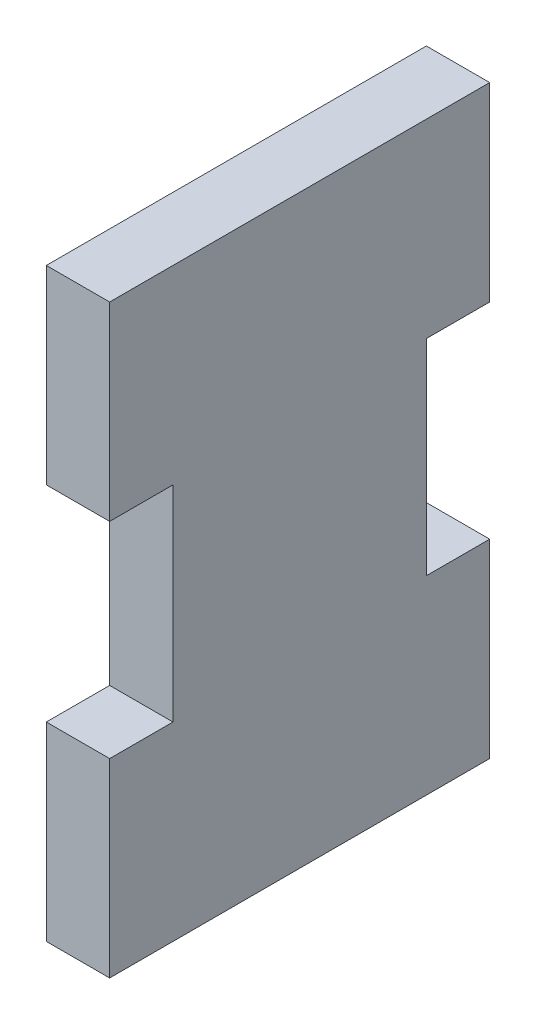
from build123d import *

# Parameters (mm, degrees)
SKETCH1_W           = 3.175
SKETCH1_H           = 29.34469697
BOSS_EXTRUDE1_DEPTH = 19.05
SKETCH2_W           = 3.175
SKETCH2_H           = 10.29469697
CUT_EXTRUDE1_DEPTH  = 5.08


with BuildPart() as part:
    # Sketch1 → Boss-Extrude1 (new body)
    with BuildSketch(Plane.XY):
        with Locations((82.43330737, 77.753797109)):
            Rectangle(SKETCH1_W, SKETCH1_H)
    extrude(amount=-BOSS_EXTRUDE1_DEPTH)

    # Sketch2 → Cut-Extrude1 (cut)
    with BuildSketch(Plane(origin=(84.02080737, 0, 0), x_dir=(0, 0, -1), z_dir=(1, 0, 0))):
        with Locations((1.5875, 77.753797109)):
            Rectangle(SKETCH2_W, SKETCH2_H)
        with Locations((17.4625, 77.753797109)):
            Rectangle(SKETCH2_W, SKETCH2_H)
    extrude(amount=-CUT_EXTRUDE1_DEPTH, mode=Mode.SUBTRACT)


solid = part.part
